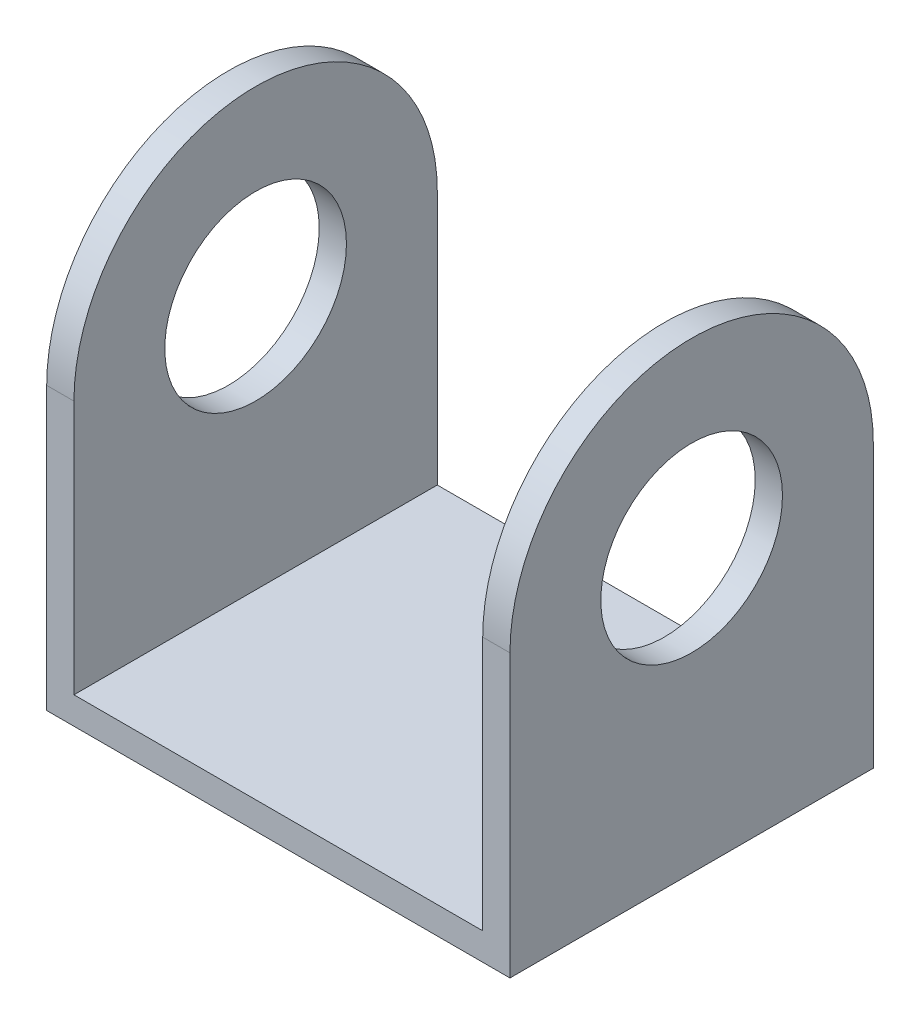
from build123d import *

# Parameters (mm, degrees)
SKETCH_1_W      = 40
SKETCH_1_H      = 3
EXTRUDE_1_DEPTH = 22.5
SKETCH_2_R      = 10
EXTRUDE_2_DEPTH = 3


with BuildPart() as part:
    # 스케치1 → 보스-돌출1 (new, symmetric)
    with BuildSketch(Plane(origin=(0, 0, 0), x_dir=(0, 0, -1), z_dir=(1, 0, 0))):
        with Locations((0, 1.5)):
            Rectangle(SKETCH_1_W, SKETCH_1_H)
    extrude(amount=EXTRUDE_1_DEPTH, both=True)

    # 스케치2 → 보스-돌출2 (add)
    with BuildSketch(Plane(origin=(22.5, 0, 0), x_dir=(0, 0, -1), z_dir=(1, 0, 0))):
        with BuildLine():
            Line((-20, 31), (-20, 0))
            Line((-20, 0), (20, 0))
            Line((20, 0), (20, 31))
            ThreePointArc((20, 31), (0, 51), (-20, 31))
        make_face()
        with Locations((0, 31)):
            Circle(SKETCH_2_R, mode=Mode.SUBTRACT)
    extrude_2 = extrude(amount=EXTRUDE_2_DEPTH)

    # 대칭 복사1: 보스-돌출2 across plane
    add(extrude_2.mirror(Plane(origin=(0, 0, 0), x_dir=(0, 0, 1), z_dir=(1, 0, 0))))


solid = part.part
